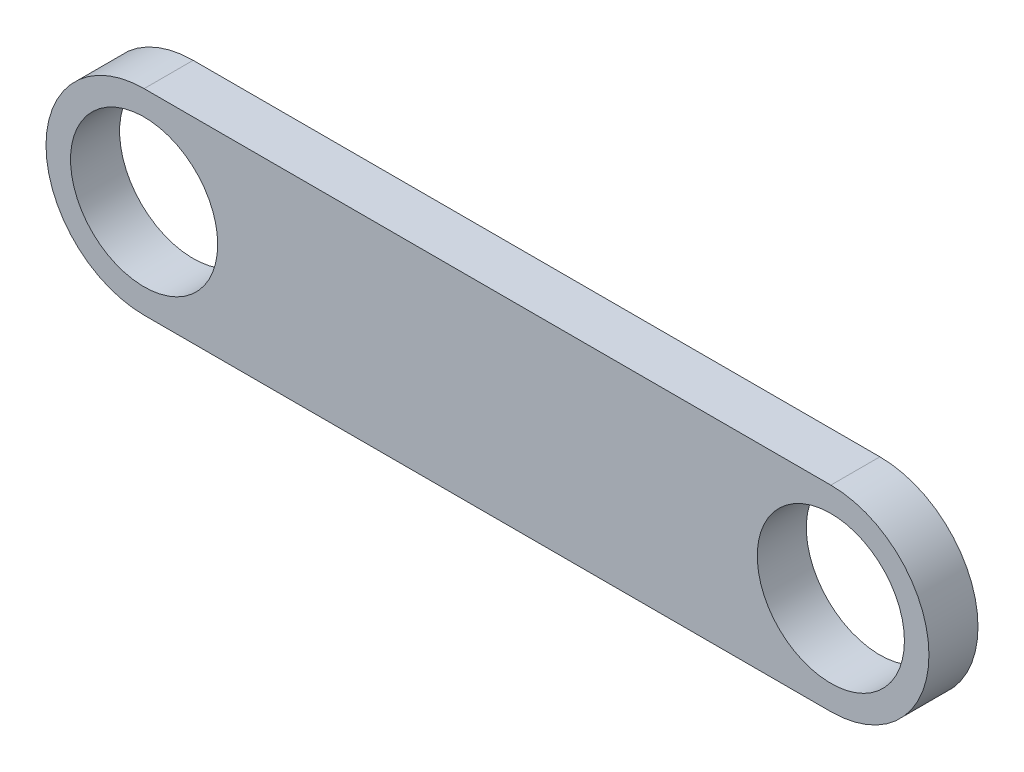
from build123d import *

# Parameters (mm, degrees)
SKETCH_1_R      = 15
EXTRUDE_2_DEPTH = 10


with BuildPart() as part:
    # Эскиз1 → Бобышка-Вытянуть2 (new body)
    with BuildSketch(Plane.XY):
        with BuildLine():
            Line((0, 20), (140, 20))
            ThreePointArc((140, 20), (160, 0), (140, -20))
            Line((140, -20), (0, -20))
            ThreePointArc((0, -20), (-20, 0), (0, 20))
        make_face()
        Circle(SKETCH_1_R, mode=Mode.SUBTRACT)
        with Locations((140, 0)):
            Circle(SKETCH_1_R, mode=Mode.SUBTRACT)
    extrude(amount=EXTRUDE_2_DEPTH)


solid = part.part
